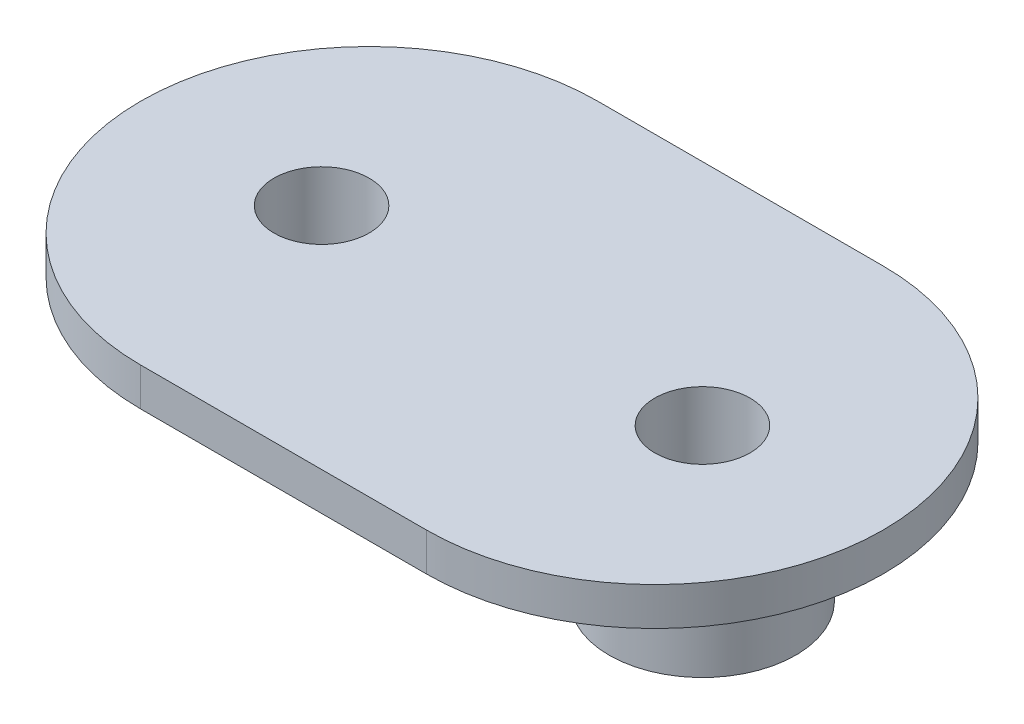
from build123d import *

# Parameters (mm, degrees)
SKETCH1_R                  = 4.9
BOSS_EXTRUDE1_DEPTH        = 2
BOSS_EXTRUDE2_DEPTH        = 2
BOSS_EXTRUDE2_DEPTH_BACK   = 6
SKETCH1_3_R                = 4.9
SKETCH1_3_R_2              = 2.5
BOSS_EXTRUDE2_2_DEPTH      = 2
BOSS_EXTRUDE2_2_DEPTH_BACK = 6
SKETCH2_R                  = 5.756408641
SKETCH2_R_2                = 3.886057863
SKETCH2_R_3                = 6.078413945
SKETCH2_R_4                = 3.85710511
BOSS_EXTRUDE3_DEPTH        = 2


with BuildPart() as part:
    # Sketch1 → Boss-Extrude1 (new body)
    with BuildSketch(Plane(origin=(0, 0, 0), x_dir=(1, 0, 0), z_dir=(0, 1, 0))):
        with BuildLine():
            Line((7.5, 12), (-7.5, 12))
            ThreePointArc((-7.5, 12), (-19.5, 0), (-7.5, -12))
            Line((-7.5, -12), (7.5, -12))
            ThreePointArc((7.5, -12), (19.5, 0), (7.5, 12))
        make_face()
        with Locations((-10, 0)):
            Circle(SKETCH1_R, mode=Mode.SUBTRACT)
        with Locations((10, 0)):
            Circle(SKETCH1_R, mode=Mode.SUBTRACT)
    extrude(amount=BOSS_EXTRUDE1_DEPTH)



with BuildPart() as body_2:
    # Sketch1<3> → Boss-Extrude2 (new, two sides: drawn at the far end of the back side and taken through both)
    with BuildSketch(Plane(origin=(0, 0, 0), x_dir=(1, 0, 0), z_dir=(0, 1, 0)).offset(-BOSS_EXTRUDE2_DEPTH_BACK)):
        with Locations((-10, 0)):
            Circle(SKETCH1_3_R)
        with Locations((-10, 0)):
            Circle(SKETCH1_3_R_2, mode=Mode.SUBTRACT)
    extrude(amount=BOSS_EXTRUDE2_DEPTH + BOSS_EXTRUDE2_DEPTH_BACK)


with BuildPart() as body_3:
    # Sketch1<3> → Boss-Extrude2 2 (new, two sides: drawn at the far end of the back side and taken through both)
    with BuildSketch(Plane(origin=(0, 0, 0), x_dir=(1, 0, 0), z_dir=(0, 1, 0)).offset(-BOSS_EXTRUDE2_2_DEPTH_BACK)):
        with Locations((10, 0)):
            Circle(SKETCH1_3_R)
        with Locations((10, 0)):
            Circle(SKETCH1_3_R_2, mode=Mode.SUBTRACT)
    extrude(amount=BOSS_EXTRUDE2_2_DEPTH + BOSS_EXTRUDE2_2_DEPTH_BACK)


with BuildPart() as part_1:
    add(part.part)

    add(body_2.part)  # Boss-Extrude3 merges body 2

    add(body_3.part)  # Boss-Extrude3 merges body 3
    # Sketch2 → Boss-Extrude3 (add)
    # profile 1 of 2: a face of its own
    with BuildSketch(Plane(origin=(0, 2, 0), x_dir=(1, 0, 0), z_dir=(0, 1, 0))):
        with Locations((-10, 0)):
            Circle(SKETCH2_R)
        with Locations((-10, 0)):
            Circle(SKETCH2_R_2, mode=Mode.SUBTRACT)
    # profile 2 of 2: a face of its own
    with BuildSketch(Plane(origin=(0, 2, 0), x_dir=(1, 0, 0), z_dir=(0, 1, 0))):
        with Locations((10, 0)):
            Circle(SKETCH2_R_3)
        with Locations((10, 0)):
            Circle(SKETCH2_R_4, mode=Mode.SUBTRACT)
    extrude(amount=-BOSS_EXTRUDE3_DEPTH)


solid = part_1.part
